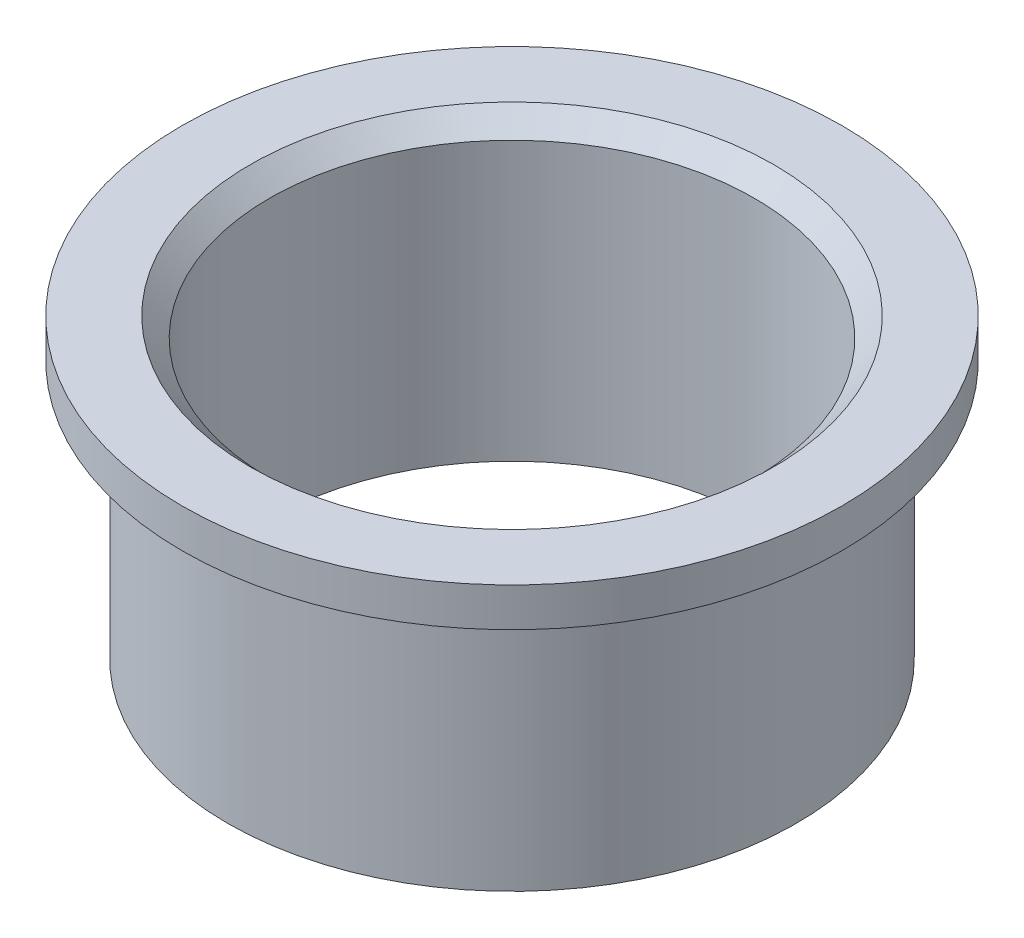
from build123d import *


with BuildPart() as part:
    # Schizzo1 → Rivoluzione1 (revolve)
    with BuildSketch(Plane.XY, mode=Mode.PRIVATE) as rivoluzione1_sk:
        Polygon((-51, 0), (-40.5, 0), (-37.5, -3), (-37.5, -46), (-44, -46), (-44, -6), (-51, -6), align=None)
    revolve(rivoluzione1_sk.sketch.rotate(Axis((0, 0, 0), (0, -1, 0)), 270), axis=Axis((0, 0, 0), (0, -1, 0)))


solid = part.part
